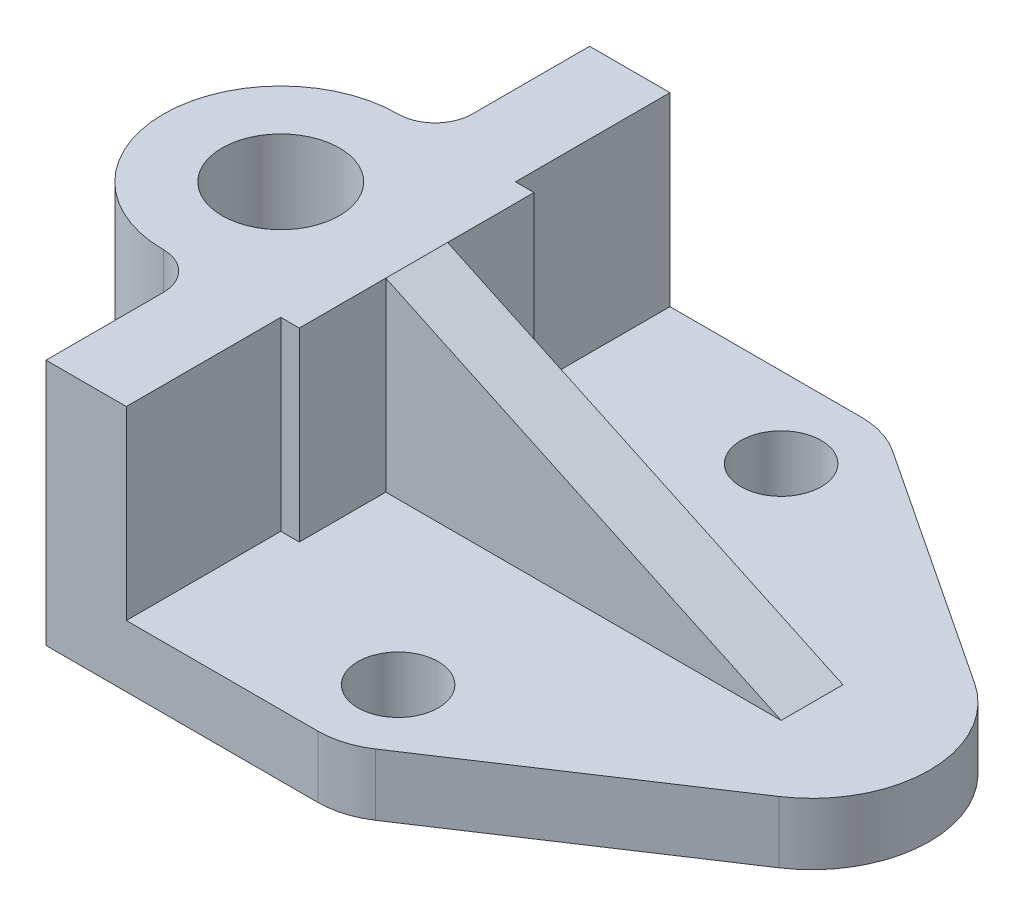
from build123d import *

# Parameters (mm, degrees)
BOSS_EXTRUDE1_DEPTH      = 20
BOSS_EXTRUDE1_DEPTH_BACK = 20
CUT_EXTRUDE1_START       = -30
CUT_EXTRUDE1_DEPTH       = 30
BOSS_EXTRUDE2_START      = -44
BOSS_EXTRUDE2_DEPTH      = 5
HOLE1_D                  = 19
HOLE2_D                  = 13


with BuildPart() as part:
    # Sketch1 → Boss-Extrude1 (new, two sides: drawn at the far end of the back side and taken through both)
    with BuildSketch(Plane(origin=(0, 0, 0), x_dir=(1, 0, 0), z_dir=(0, 1, 0)).offset(-BOSS_EXTRUDE1_DEPTH_BACK)):
        with BuildLine():
            Line((6, 25), (6, 44))
            Line((6, 44), (50, 44))
            ThreePointArc((50, 44), (53.744006319, 43.449193415), (57.170747509, 41.843448721))
            Line((57.170747509, 41.843448721), (96.480323283, 15.848117361))
            ThreePointArc((96.480323283, 15.848117361), (105, 0), (96.480323283, -15.848117361))
            Line((96.480323283, -15.848117361), (57.170747509, -41.843448721))
            ThreePointArc((57.170747509, -41.843448721), (53.744006319, -43.449193415), (50, -44))
            Line((50, -44), (6, -44))
            Line((6, -44), (6, -25))
            ThreePointArc((6, -25), (4.242640687, -20.757359313), (0, -19))
            ThreePointArc((0, -19), (-19, 0), (0, 19))
            ThreePointArc((0, 19), (4.242640687, 20.757359313), (6, 25))
        make_face()
    extrude(amount=BOSS_EXTRUDE1_DEPTH + BOSS_EXTRUDE1_DEPTH_BACK)

    # Sketch2 → Cut-Extrude1 (cut)
    with BuildSketch(Plane(origin=(0, 20, 0), x_dir=(1, 0, 0), z_dir=(0, 1, 0)).offset(CUT_EXTRUDE1_START)):
        with BuildLine():
            Line((19, 44), (19, 19))
            Line((19, 19), (22, 19))
            Line((22, 19), (22, -19))
            Line((22, -19), (19, -19))
            Line((19, -19), (19, -44))
            Line((19, -44), (50, -44))
            ThreePointArc((50, -44), (53.744006319, -43.449193415), (57.170747509, -41.843448721))
            Line((57.170747509, -41.843448721), (96.480323283, -15.848117361))
            ThreePointArc((96.480323283, -15.848117361), (105, 0), (96.480323283, 15.848117361))
            Line((96.480323283, 15.848117361), (57.170747509, 41.843448721))
            ThreePointArc((57.170747509, 41.843448721), (53.744006319, 43.449193415), (50, 44))
            Line((50, 44), (19, 44))
        make_face()
    extrude(amount=CUT_EXTRUDE1_DEPTH, mode=Mode.SUBTRACT)

    # Sketch3 → Boss-Extrude2 (add, symmetric)
    with BuildSketch(Plane.XY.offset(44).offset(BOSS_EXTRUDE2_START)):
        Polygon((22, 20), (86, -10), (57.170747509, -10), (50, -10), (22, -10), align=None)
    extrude(amount=BOSS_EXTRUDE2_DEPTH, both=True)

    # Hole1 (through all)
    with Locations(Plane(origin=(0, 20, 0), x_dir=(1, 0, 0), z_dir=(0, 1, 0))):
        with Locations((0, 0)):
            Hole(HOLE1_D / 2)

    # Hole2 (through all)
    with Locations(Plane(origin=(0, -10, 0), x_dir=(1, 0, 0), z_dir=(0, 1, 0))):
        with Locations((50, -31), (50, 31)):
            Hole(HOLE2_D / 2)


solid = part.part
